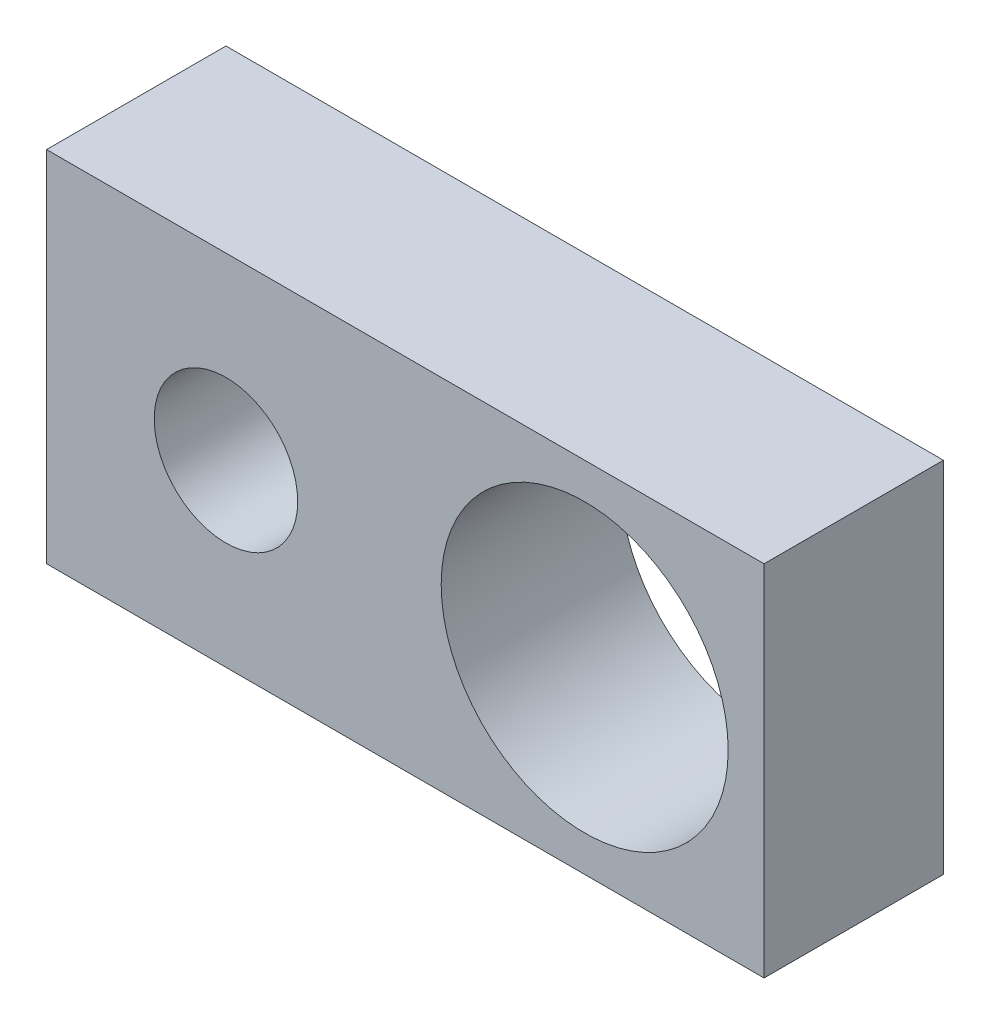
from build123d import *

# Parameters (mm, degrees)
ESQUISSE1_W        = 40
ESQUISSE1_H        = 20
ESQUISSE1_R        = 4
ESQUISSE1_R_2      = 8
BOSS_EXTRU_1_DEPTH = 10


with BuildPart() as part:
    # Esquisse1 → Boss.-Extru.1 (new body)
    with BuildSketch(Plane.XY):
        Rectangle(ESQUISSE1_W, ESQUISSE1_H)
        with Locations((-10, 0)):
            Circle(ESQUISSE1_R, mode=Mode.SUBTRACT)
        with Locations((10, 0)):
            Circle(ESQUISSE1_R_2, mode=Mode.SUBTRACT)
    extrude(amount=BOSS_EXTRU_1_DEPTH)


solid = part.part
